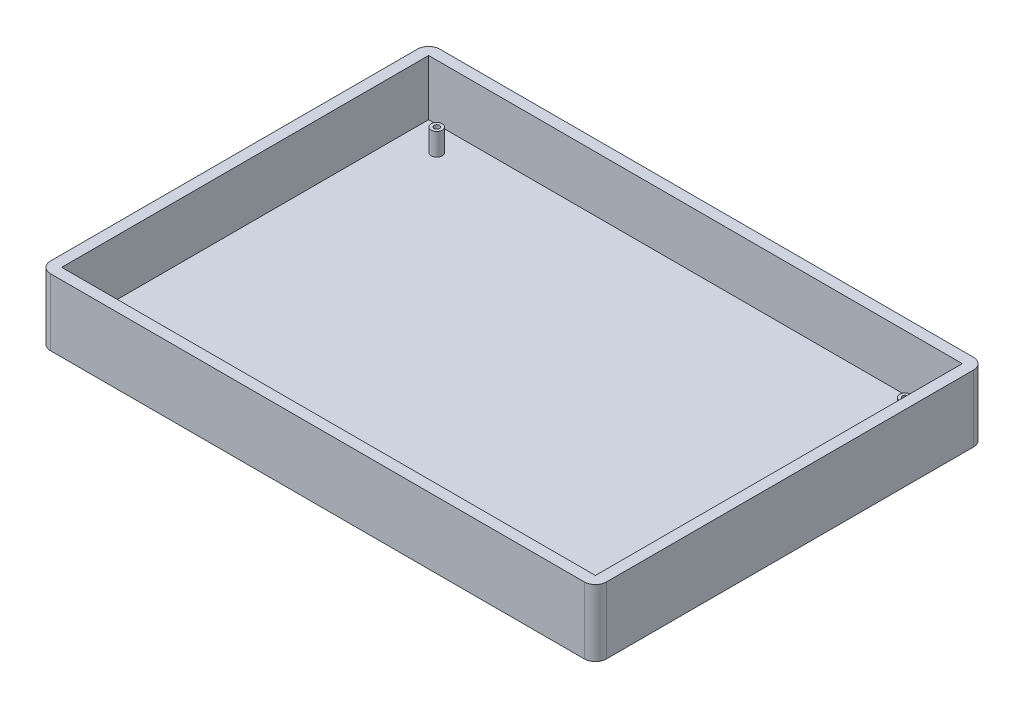
from build123d import *

# Parameters (mm, degrees)
SKETCH1_W           = 250
SKETCH1_H           = 175
BOSS_EXTRUDE1_DEPTH = 30
FILLET1_R           = 5
SKETCH3_W           = 240
SKETCH3_H           = 165
CUT_EXTRUDE1_DEPTH  = 25
SKETCH4_R           = 2.5
SKETCH4_R_2         = 1.25
BOSS_EXTRUDE2_DEPTH = 10


with BuildPart() as part:
    # Sketch1 → Boss-Extrude1 (new body)
    with BuildSketch(Plane(origin=(0, 0, 0), x_dir=(1, 0, 0), z_dir=(0, 1, 0))):
        Rectangle(SKETCH1_W, SKETCH1_H)
    extrude(amount=BOSS_EXTRUDE1_DEPTH)

    # Fillet1
    fillet1_edges = [part.edges().sort_by_distance(p)[0] for p in [
        (125, 15, 87.5),
        (-125, 15, 87.5),
        (-125, 15, -87.5),
        (125, 15, -87.5),
    ]]
    fillet(fillet1_edges, radius=FILLET1_R)

    # Sketch3 → Cut-Extrude1 (cut)
    with BuildSketch(Plane(origin=(0, 30, 0), x_dir=(1, 0, 0), z_dir=(0, 1, 0))):
        Rectangle(SKETCH3_W, SKETCH3_H)
    extrude(amount=-CUT_EXTRUDE1_DEPTH, mode=Mode.SUBTRACT)

    # Sketch4 → Boss-Extrude2 (add)
    # profile 1 of 4: a face of its own
    with BuildSketch(Plane(origin=(0, 5, 0), x_dir=(1, 0, 0), z_dir=(0, 1, 0))):
        with Locations(Location((-105.355, 71.49, 0), (0, 0, 270))):
            Circle(SKETCH4_R)
        with Locations(Location((-105.355, 71.49, 0), (0, 0, 270))):
            Circle(SKETCH4_R_2, mode=Mode.SUBTRACT)
    # profile 2 of 4: a face of its own
    with BuildSketch(Plane(origin=(0, 5, 0), x_dir=(1, 0, 0), z_dir=(0, 1, 0))):
        with Locations(Location((105.355, 71.49, 0), (0, 0, 270))):
            Circle(SKETCH4_R)
        with Locations(Location((105.355, 71.49, 0), (0, 0, 270))):
            Circle(SKETCH4_R_2, mode=Mode.SUBTRACT)
    # profile 3 of 4: a face of its own
    with BuildSketch(Plane(origin=(0, 5, 0), x_dir=(1, 0, 0), z_dir=(0, 1, 0))):
        with Locations(Location((105.355, -71.49, 0), (0, 0, 270))):
            Circle(SKETCH4_R)
        with Locations(Location((105.355, -71.49, 0), (0, 0, 270))):
            Circle(SKETCH4_R_2, mode=Mode.SUBTRACT)
    # profile 4 of 4: a face of its own
    with BuildSketch(Plane(origin=(0, 5, 0), x_dir=(1, 0, 0), z_dir=(0, 1, 0))):
        with Locations(Location((-105.355, -71.49, 0), (0, 0, 270))):
            Circle(SKETCH4_R)
        with Locations(Location((-105.355, -71.49, 0), (0, 0, 270))):
            Circle(SKETCH4_R_2, mode=Mode.SUBTRACT)
    extrude(amount=BOSS_EXTRUDE2_DEPTH)


solid = part.part
